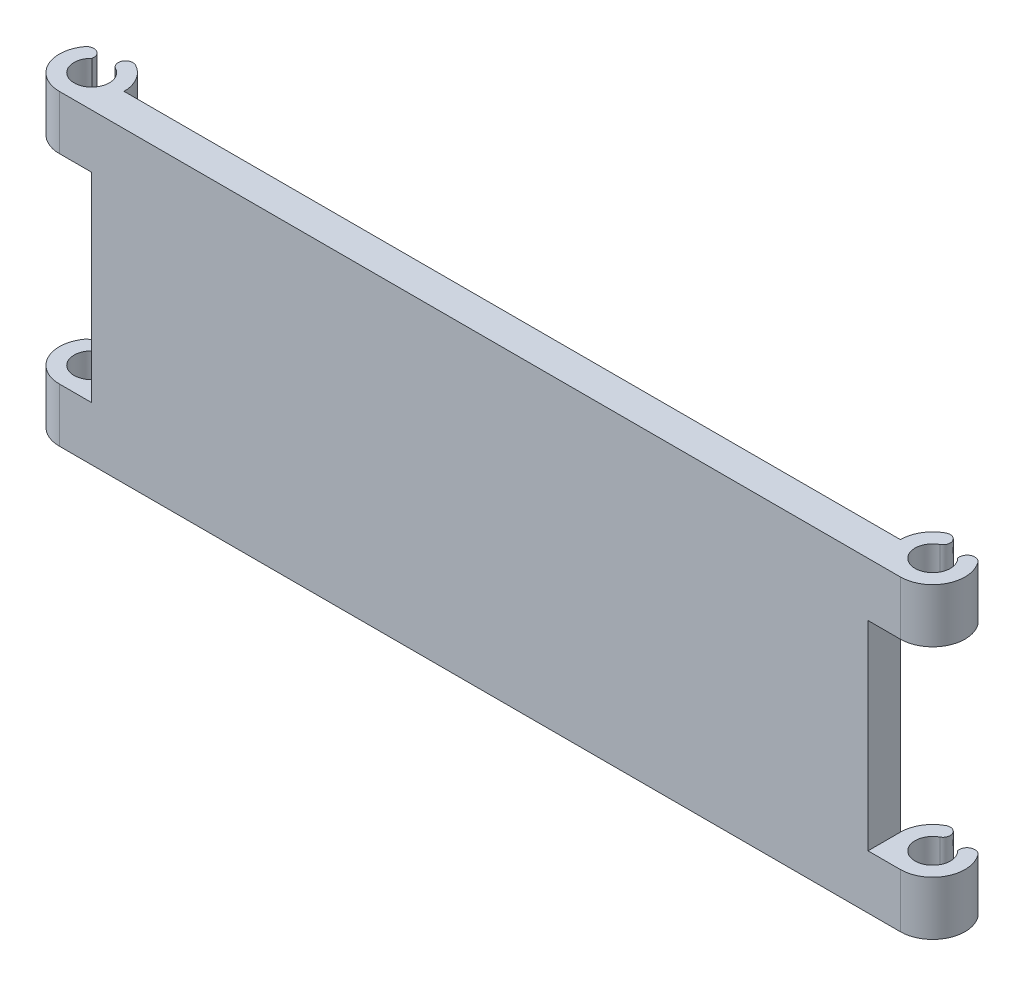
from build123d import *

# Parameters (mm, degrees)
RESSALTO_EXTRUS_O1_DEPTH = 57
CORTE_EXTRUS_O1_DEPTH    = 18.5


with BuildPart() as part:
    # Esboço1 → Ressalto-extrusão1 (new body)
    with BuildSketch(Plane(origin=(0, 0, 0), x_dir=(1, 0, 0), z_dir=(0, 1, 0))):
        with BuildLine():
            Line((-72, 0), (72, 0))
            ThreePointArc((72, 0), (72.85009345, 3.078711179), (75.159487509, 5.285024956))
            ThreePointArc((75.159487509, 5.285024956), (77.004661638, 4.729916917), (76.449553599, 2.884742789))
            ThreePointArc((76.449553599, 2.884742789), (77.536782743, -3.242075689), (80.296246294, 2.335139815))
            ThreePointArc((80.296246294, 2.335139815), (81.096189798, 3.978813584), (82.863892701, 3.513196237))
            ThreePointArc((82.863892701, 3.513196237), (83.342245662, -2.731375348), (78, -6))
            Line((78, -6), (-78, -6))
            ThreePointArc((-78, -6), (-83.342245662, -2.731375348), (-82.863892701, 3.513196237))
            ThreePointArc((-82.863892701, 3.513196237), (-81.096189798, 3.978813584), (-80.296246294, 2.335139815))
            ThreePointArc((-80.296246294, 2.335139815), (-77.536782743, -3.242075689), (-76.449553599, 2.884742789))
            ThreePointArc((-76.449553599, 2.884742789), (-77.004661638, 4.729916917), (-75.159487509, 5.285024956))
            ThreePointArc((-75.159487509, 5.285024956), (-72.85009345, 3.078711179), (-72, 0))
        make_face()
    extrude(amount=RESSALTO_EXTRUS_O1_DEPTH)

    # Esboço3 → Corte-extrusão1 (cut, symmetric)
    with BuildSketch(Plane(origin=(0, 28.5, 0), x_dir=(1, 0, 0), z_dir=(0, 1, 0))):
        with BuildLine():
            Line((-72, 0), (-72, -6))
            Line((-72, -6), (-78, -6))
            ThreePointArc((-78, -6), (-82.242640687, 4.242640687), (-72, 0))
        make_face()
        with BuildLine():
            Line((72, 0), (72, -6))
            Line((72, -6), (78, -6))
            ThreePointArc((78, -6), (82.242640687, 4.242640687), (72, 0))
        make_face()
    extrude(amount=CORTE_EXTRUS_O1_DEPTH, both=True, mode=Mode.SUBTRACT)


solid = part.part
